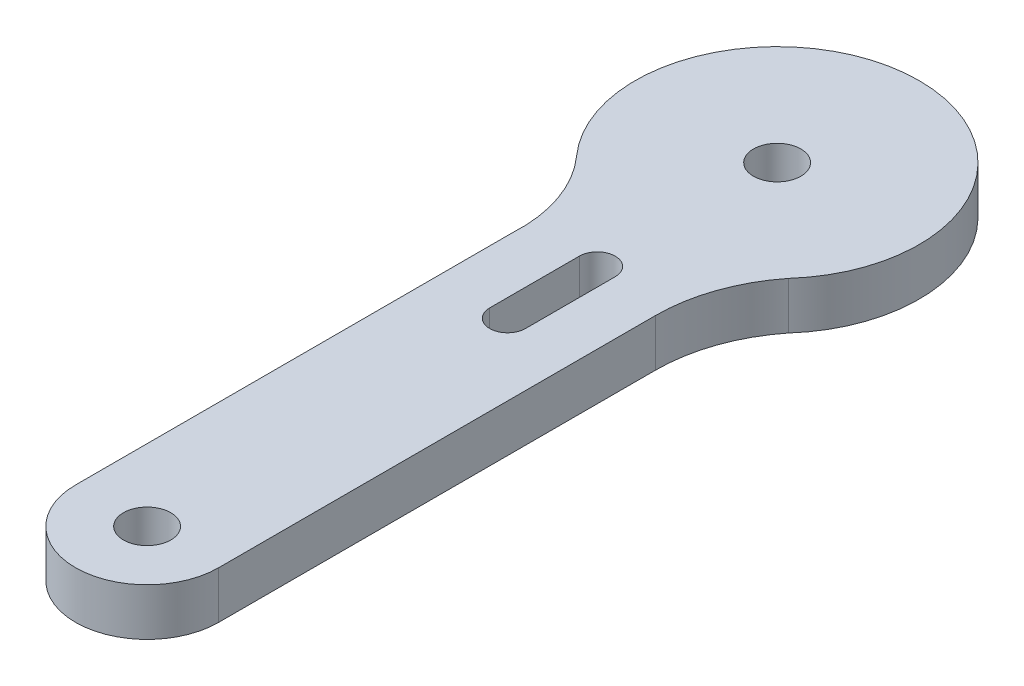
from build123d import *

# Parameters (mm, degrees)
SKETCH1_R           = 1.524
BOSS_EXTRUDE1_DEPTH = 3.048


with BuildPart() as part:
    # Sketch1 → Boss-Extrude1 (new body)
    with BuildSketch(Plane(origin=(0, 0, 0), x_dir=(1, 0, 0), z_dir=(0, 1, 0))):
        with BuildLine():
            Line((4.120039677, 7.385454502), (4.120039677, -20.735478746))
            ThreePointArc((4.120039677, -20.735478746), (-0.490464098, -25.345982522), (-5.100967874, -20.735478746))
            Line((-5.100967874, -20.735478746), (-5.100967874, 7.385454502))
            ThreePointArc((-5.100967874, 7.385454502), (-5.569137189, 10.778713446), (-7.306945844, 13.730561993))
            ThreePointArc((-7.306945844, 13.730561993), (-0.490464096, 28.96950355), (6.326017651, 13.730561993))
            ThreePointArc((6.326017651, 13.730561993), (4.687262198, 10.744276018), (4.120039677, 7.385454502))
        make_face()
        with Locations(Location((-0.490464098, -20.735478746, 0), (0, 0, 90))):
            Circle(SKETCH1_R, mode=Mode.SUBTRACT)
        with Locations(Location((-0.490464096, 19.82550355, 0), (0, 0, 90))):
            Circle(SKETCH1_R, mode=Mode.SUBTRACT)
        with BuildLine():
            Line((-1.643126624, 8.246871525), (-1.643126624, 2.47327546))
            ThreePointArc((-1.643126624, 2.47327546), (-0.49050068, 1.320649517), (0.662125264, 2.47327546))
            Line((0.662125264, 2.47327546), (0.662125264, 8.246871525))
            ThreePointArc((0.662125264, 8.246871525), (-0.49050068, 9.399497469), (-1.643126624, 8.246871525))
        make_face(mode=Mode.SUBTRACT)
    extrude(amount=BOSS_EXTRUDE1_DEPTH)


solid = part.part
